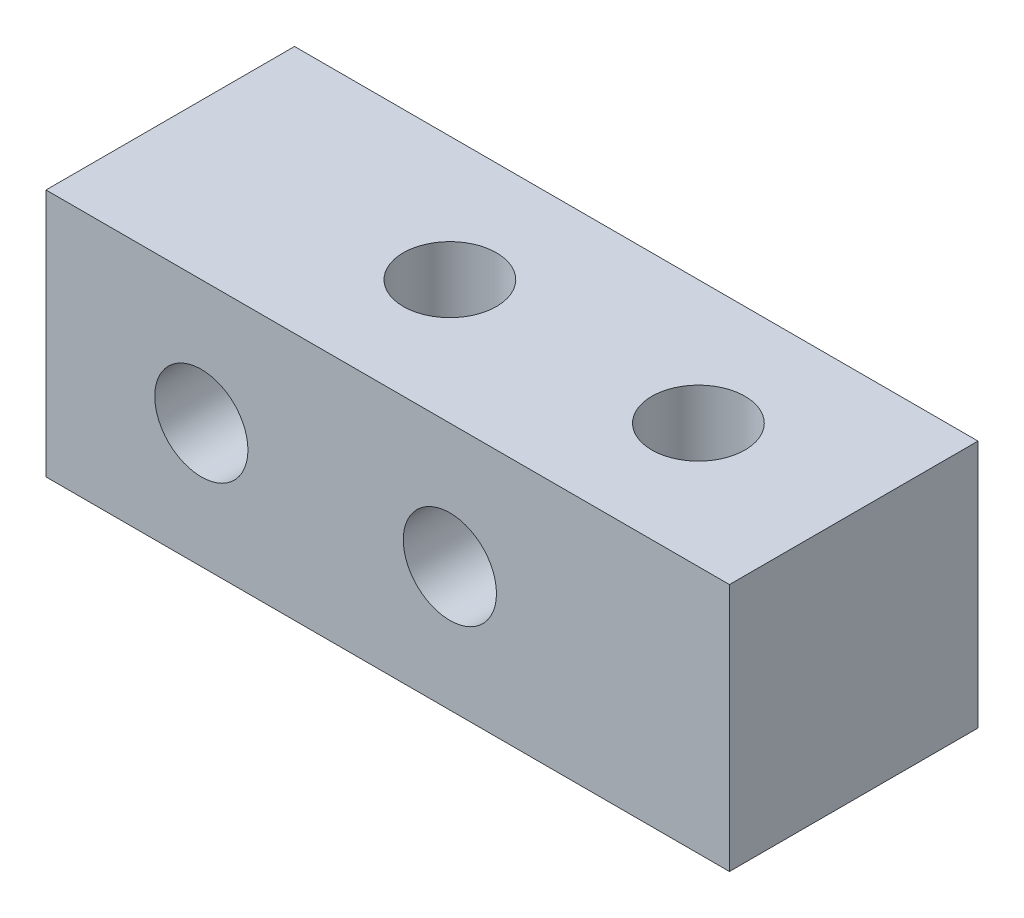
from build123d import *

# Parameters (mm, degrees)
SKETCH_1_W          = 22
SKETCH_1_H          = 8
EXTRUDE_1_DEPTH     = 8
SKETCH_2_R          = 1.5
CUT_EXTRUDE_1_DEPTH = 8
SKETCH_3_R          = 1.5
CUT_EXTRUDE_2_DEPTH = 8


with BuildPart() as part:
    # 草图1 → 凸台-拉伸1 (new body)
    with BuildSketch(Plane(origin=(0, 0, 0), x_dir=(1, 0, 0), z_dir=(0, 1, 0))):
        with Locations((11, -4)):
            Rectangle(SKETCH_1_W, SKETCH_1_H)
    extrude(amount=EXTRUDE_1_DEPTH)

    # 草图2 → 切除-拉伸1 (cut)
    with BuildSketch(Plane(origin=(0, 8, 0), x_dir=(1, 0, 0), z_dir=(0, 1, 0))):
        with Locations(Location((17, -4, 0), (0, 0, 270))):
            Circle(SKETCH_2_R)
        with Locations(Location((9, -4, 0), (0, 0, 270))):
            Circle(SKETCH_2_R)
    extrude(amount=-CUT_EXTRUDE_1_DEPTH, mode=Mode.SUBTRACT)

    # 草图3 → 切除-拉伸2 (cut)
    with BuildSketch(Plane.XY.offset(8)):
        with Locations((5, 4)):
            Circle(SKETCH_3_R)
        with Locations((13, 4)):
            Circle(SKETCH_3_R)
    extrude(amount=-CUT_EXTRUDE_2_DEPTH, mode=Mode.SUBTRACT)


solid = part.part
